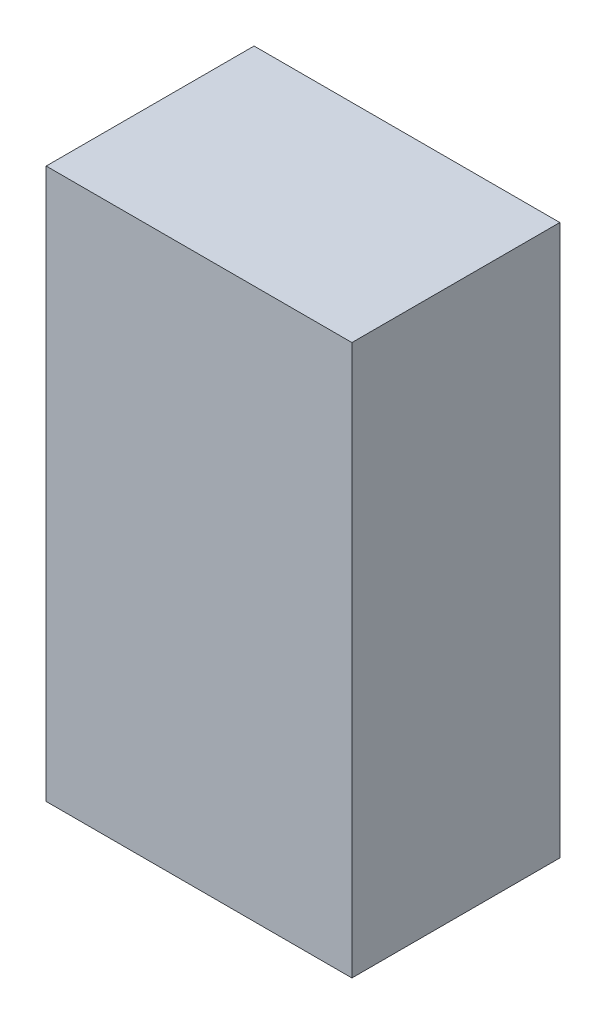
from build123d import *

# Parameters (mm, degrees)
SKETCH_1_W      = 25
SKETCH_1_H      = 17
EXTRUDE_1_DEPTH = 45


with BuildPart() as part:
    # Эскиз1 → Бобышка-Вытянуть1 (new body)
    with BuildSketch(Plane(origin=(0, 0, 0), x_dir=(1, 0, 0), z_dir=(0, 1, 0))):
        Rectangle(SKETCH_1_W, SKETCH_1_H)
    extrude(amount=EXTRUDE_1_DEPTH)


solid = part.part
